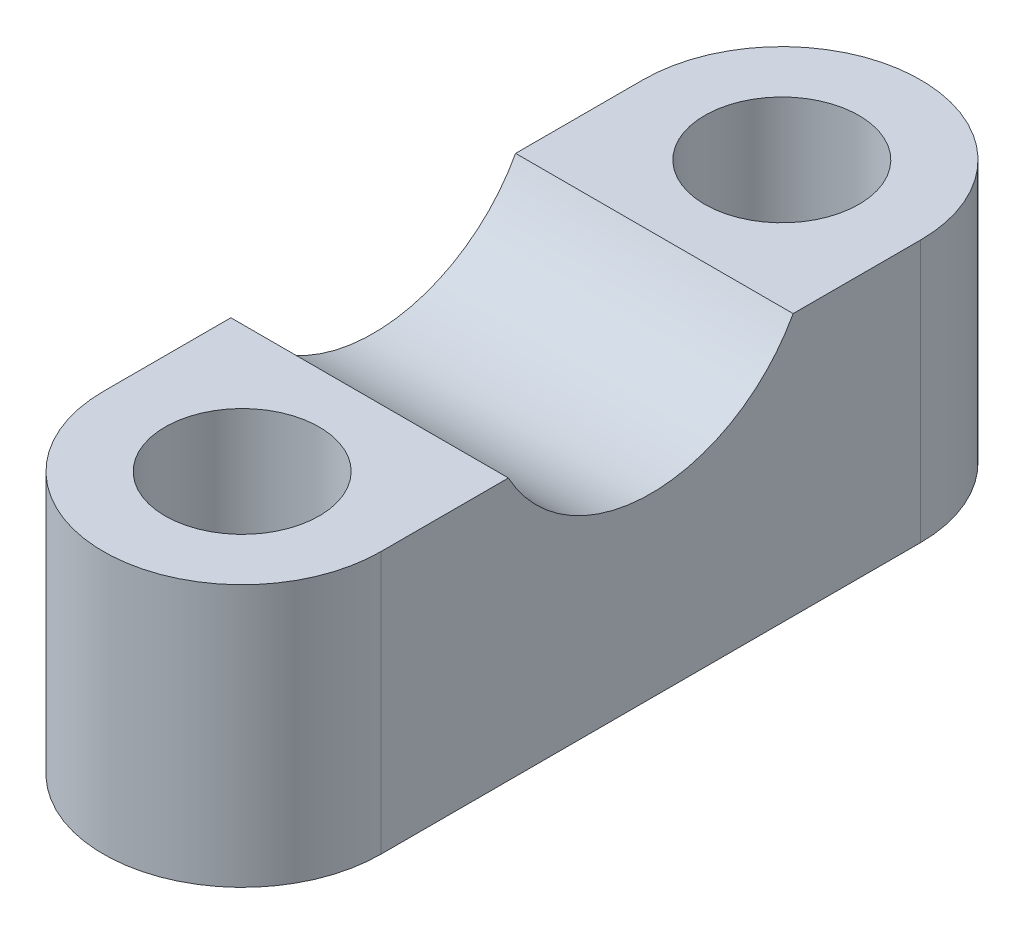
from build123d import *

# Parameters (mm, degrees)
SKETCH1_R           = 5
BOSS_EXTRUDE1_DEPTH = 17
SKETCH2_R           = 10.5
CUT_EXTRUDE1_DEPTH  = 64
CUT_EXTRUDE2_DEPTH  = 8


with BuildPart() as part:
    # Sketch1 → Boss-Extrude1 (new body)
    with BuildSketch(Plane(origin=(0, 0, 0), x_dir=(1, 0, 0), z_dir=(0, 1, 0))):
        with BuildLine():
            Line((-38, 0), (-38, 35))
            ThreePointArc((-38, 35), (-47, 44), (-56, 35))
            Line((-56, 35), (-56, 0))
            ThreePointArc((-56, 0), (-47, -9), (-38, 0))
        make_face()
        with Locations(Location((-47, 35, 0), (0, 0, 270))):
            Circle(SKETCH1_R, mode=Mode.SUBTRACT)
        with Locations(Location((-47, 0, 0), (0, 0, 270))):
            Circle(SKETCH1_R, mode=Mode.SUBTRACT)
    extrude(amount=BOSS_EXTRUDE1_DEPTH)

    # Sketch2 → Cut-Extrude1 (cut)
    with BuildSketch(Plane(origin=(0, 0, 0), x_dir=(0, 0, -1), z_dir=(1, 0, 0))):
        with Locations((17.5, 22)):
            Circle(SKETCH2_R)
    extrude(amount=-CUT_EXTRUDE1_DEPTH, mode=Mode.SUBTRACT)

    # Sketch3 → Cut-Extrude2 (cut)
    with BuildSketch(Plane.XZ):
        with BuildLine():
            Line((-52, -7.483314774), (-52, -27.516685226))
            ThreePointArc((-52, -27.516685226), (-47, -26), (-42, -27.516685226))
            Line((-42, -27.516685226), (-42, -7.483314774))
            ThreePointArc((-42, -7.483314774), (-47, -9), (-52, -7.483314774))
        make_face()
    extrude(amount=-CUT_EXTRUDE2_DEPTH, mode=Mode.SUBTRACT)


solid = part.part
